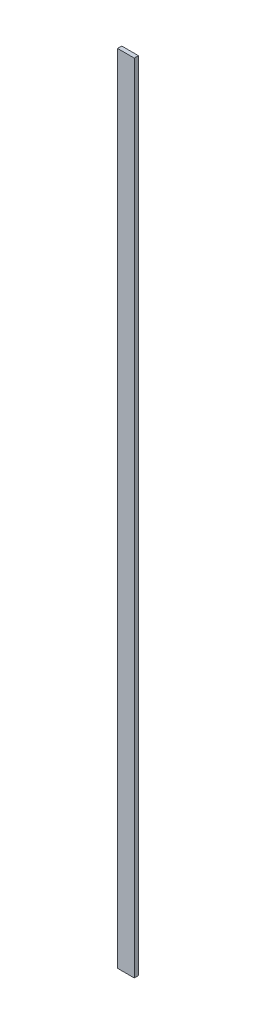
from build123d import *

# Parameters (mm, degrees)
SKETCH1_W           = 6.35
SKETCH1_H           = 302.264406918
BOSS_EXTRUDE2_DEPTH = 1.5875


with BuildPart() as part:
    # Sketch1 → Boss-Extrude2 (new body)
    with BuildSketch(Plane.XY):
        with Locations((-31.344794931, 62.782026797)):
            Rectangle(SKETCH1_W, SKETCH1_H)
    extrude(amount=BOSS_EXTRUDE2_DEPTH)


solid = part.part
